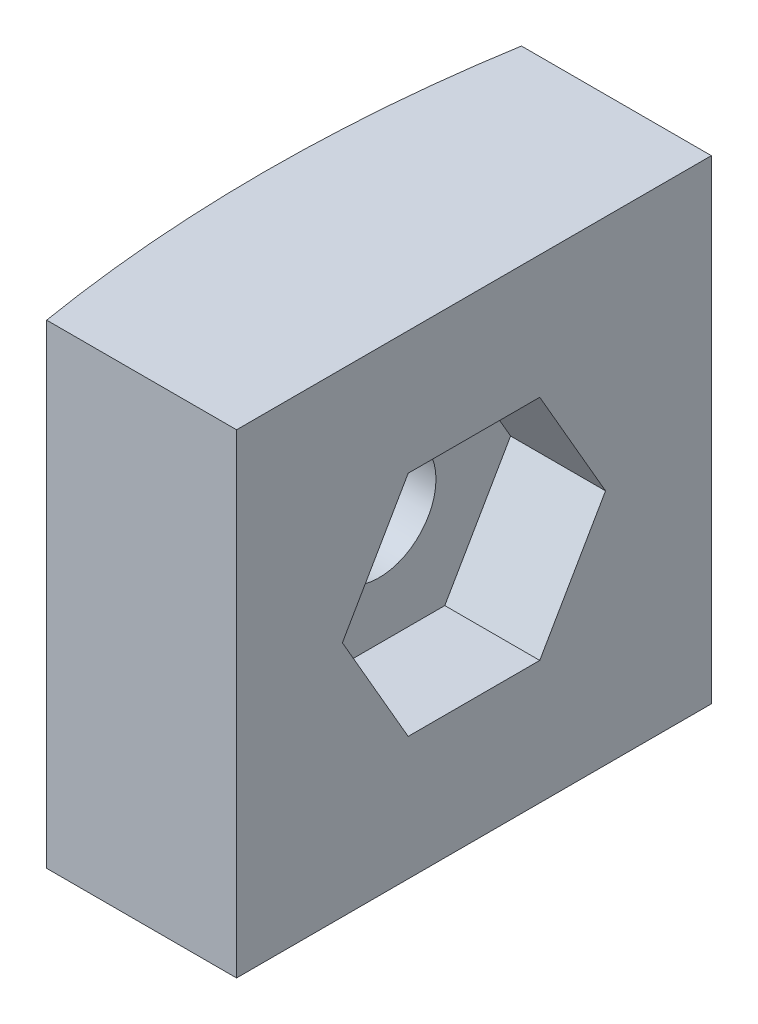
from build123d import *

# Parameters (mm, degrees)
BOSS_EXTRUDE1_DEPTH = 25
SKETCH2_R           = 3
CUT_EXTRUDE1_DEPTH  = 25
SKETCH3_W           = 25
SKETCH3_H           = 25
BOSS_EXTRUDE2_DEPTH = 5


with BuildPart() as part:
    # Sketch1 → Boss-Extrude1 (new body)
    with BuildSketch(Plane(origin=(0, 0, 0), x_dir=(1, 0, 0), z_dir=(0, 1, 0))):
        with BuildLine():
            Line((-65.504745346, 11.478381524), (-65.504745346, -13.521618476))
            Line((-65.504745346, -13.521618476), (-70.504745346, -13.521618476))
            ThreePointArc((-70.504745346, -13.521618476), (-71.536999603, -1.021618476), (-70.504745346, 11.478381524))
            Line((-70.504745346, 11.478381524), (-65.504745346, 11.478381524))
        make_face()
    extrude(amount=BOSS_EXTRUDE1_DEPTH)

    # Sketch2 → Cut-Extrude1 (cut)
    with BuildSketch(Plane(origin=(-65.504745346, 0, 0), x_dir=(0, 0, -1), z_dir=(1, 0, 0))):
        with Locations((-1.021618476, 12.5)):
            Circle(SKETCH2_R)
    extrude(amount=-CUT_EXTRUDE1_DEPTH, mode=Mode.SUBTRACT)

    # Sketch3 → Boss-Extrude2 (add)
    with BuildSketch(Plane(origin=(-65.504745346, 0, 0), x_dir=(0, 0, -1), z_dir=(1, 0, 0))):
        with Locations((-1.021618476, 12.5)):
            Rectangle(SKETCH3_W, SKETCH3_H)
        Polygon((5.906584755, 12.5), (2.442483139, 18.5), (-4.485720091, 18.5), (-7.949821706, 12.5), (-4.485720091, 6.5), (2.442483139, 6.5), align=None, mode=Mode.SUBTRACT)
    extrude(amount=BOSS_EXTRUDE2_DEPTH)


solid = part.part
